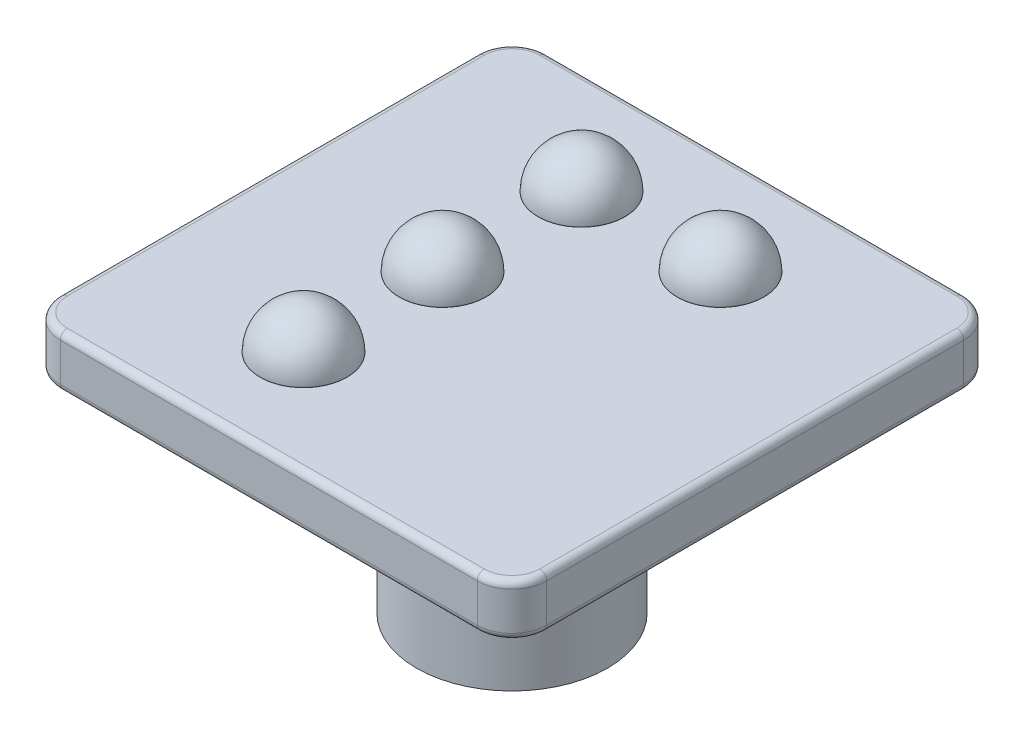
from build123d import *

# Parameters (mm, degrees)
BOSS_EXTRUDE1_DEPTH = 1.5
SKETCH2_R           = 2.75
BOSS_EXTRUDE2_DEPTH = 6
SKETCH3_W           = 1.1
SKETCH3_H           = 1.45
SKETCH3_W_2         = 1.45
SKETCH3_H_2         = 1.1
CUT_EXTRUDE1_DEPTH  = 6
CHAMFER1_SIZE       = 0.3
FILLET1_R           = 1
SKETCH4_R           = 1.25
BOSS_EXTRUDE3_DEPTH = 0.01
DOME1_FACE_RADIUS   = 1.25
DOME1_HEIGHT        = 1.25
DOME2_FACE_RADIUS   = 1.25
DOME2_HEIGHT        = 1.25
DOME3_FACE_RADIUS   = 1.25
DOME3_HEIGHT        = 1.25
DOME5_FACE_RADIUS   = 1.25
DOME5_HEIGHT        = 1.25
FILLET3_R           = 0.2


with BuildPart() as part:
    # Sketch1 → Boss-Extrude1 (new body)
    with BuildSketch(Plane(origin=(0, 0, 0), x_dir=(1, 0, 0), z_dir=(0, 1, 0))):
        with BuildLine():
            Line((-7.324675649, 4.396717546), (4.675324351, 4.396717546))
            ThreePointArc((4.675324351, 4.396717546), (5.382431132, 4.103824327), (5.675324351, 3.396717546))
            Line((5.675324351, 3.396717546), (5.675324351, -8.603282454))
            ThreePointArc((5.675324351, -8.603282454), (5.382431132, -9.310389235), (4.675324351, -9.603282454))
            Line((4.675324351, -9.603282454), (-7.324675649, -9.603282454))
            ThreePointArc((-7.324675649, -9.603282454), (-8.03178243, -9.310389235), (-8.324675649, -8.603282454))
            Line((-8.324675649, -8.603282454), (-8.324675649, 3.396717546))
            ThreePointArc((-8.324675649, 3.396717546), (-8.03178243, 4.103824327), (-7.324675649, 4.396717546))
        make_face()
    extrude(amount=BOSS_EXTRUDE1_DEPTH)

    # Sketch2 → Boss-Extrude2 (add)
    with BuildSketch(Plane.XZ):
        with Locations(Location((-1.324675649, 2.603282454, 0), (0, 0, 270))):
            Circle(SKETCH2_R)
    extrude(amount=BOSS_EXTRUDE2_DEPTH)

    # Sketch3 → Cut-Extrude1 (cut)
    with BuildSketch(Plane.XZ.offset(6)):
        with Locations((-1.324675649, 3.878282454)):
            Rectangle(SKETCH3_W, SKETCH3_H)
        with Locations((-0.049675649, 2.603282454)):
            Rectangle(SKETCH3_W_2, SKETCH3_H_2)
        with Locations((-1.324675649, 2.603282454)):
            Rectangle(SKETCH3_W, SKETCH3_H_2)
        with Locations((-2.599675649, 2.603282454)):
            Rectangle(SKETCH3_W_2, SKETCH3_H_2)
        with Locations((-1.324675649, 1.328282454)):
            Rectangle(SKETCH3_W, SKETCH3_H)
    extrude(amount=-CUT_EXTRUDE1_DEPTH, mode=Mode.SUBTRACT)

    # Chamfer1
    chamfer1_edges = [part.edges().sort_by_distance(p)[0] for p in [
        (-0.774675649, -6, 3.878282454),
        (-0.049675649, -6, 3.153282454),
        (0.675324351, -6, 2.603282454),
        (-0.774675649, -6, 1.328282454),
        (-2.599675649, -6, 3.153282454),
        (-1.324675649, -6, 4.603282454),
        (-1.874675649, -6, 3.878282454),
        (-3.324675649, -6, 2.603282454),
        (-2.599675649, -6, 2.053282454),
        (-1.874675649, -6, 1.328282454),
        (-1.324675649, -6, 0.603282454),
        (-0.049675649, -6, 2.053282454),
    ]]
    chamfer(chamfer1_edges, length=CHAMFER1_SIZE)

    # Fillet1
    fillet1_edges = [part.edges().sort_by_distance(p)[0] for p in [
        (-1.324675649, 0, 5.353282454),
    ]]
    fillet(fillet1_edges, radius=FILLET1_R)

    # Sketch4 → Boss-Extrude3 (add)
    with BuildSketch(Plane(origin=(0, 1.5, 0), x_dir=(1, 0, 0), z_dir=(0, 1, 0))):
        with Locations(Location((-3.324675649, 1.396717546, 0), (0, 0, 90))):
            Circle(SKETCH4_R)
        with Locations(Location((-3.324675649, -2.603282454, 0), (0, 0, 90))):
            Circle(SKETCH4_R)
        with Locations(Location((-3.324675649, -6.603282454, 0), (0, 0, 90))):
            Circle(SKETCH4_R)
        with Locations(Location((0.675324351, 1.396717546, 0), (0, 0, 90))):
            Circle(SKETCH4_R)
    extrude(amount=BOSS_EXTRUDE3_DEPTH)

    # Dome1: a dome of height H over a round flat face of radius A is a cap of a sphere of radius (A * A + H * H) / (2 * H)
    dome1_r = (DOME1_FACE_RADIUS * DOME1_FACE_RADIUS + DOME1_HEIGHT * DOME1_HEIGHT) / (2 * DOME1_HEIGHT)
    dome1_base = Plane((-3.324675649, 1.51, -1.396717546), z_dir=(0, 1, 0))
    with Locations(dome1_base.offset(DOME1_HEIGHT - dome1_r)):
        dome1_ball = Sphere(dome1_r, mode=Mode.PRIVATE)
    add(split(dome1_ball, bisect_by=dome1_base, keep=Keep.TOP, mode=Mode.PRIVATE))

    # Dome2: a dome of height H over a round flat face of radius A is a cap of a sphere of radius (A * A + H * H) / (2 * H)
    dome2_r = (DOME2_FACE_RADIUS * DOME2_FACE_RADIUS + DOME2_HEIGHT * DOME2_HEIGHT) / (2 * DOME2_HEIGHT)
    dome2_base = Plane((0.675324351, 1.51, -1.396717546), z_dir=(0, 1, 0))
    with Locations(dome2_base.offset(DOME2_HEIGHT - dome2_r)):
        dome2_ball = Sphere(dome2_r, mode=Mode.PRIVATE)
    add(split(dome2_ball, bisect_by=dome2_base, keep=Keep.TOP, mode=Mode.PRIVATE))

    # Dome3: a dome of height H over a round flat face of radius A is a cap of a sphere of radius (A * A + H * H) / (2 * H)
    dome3_r = (DOME3_FACE_RADIUS * DOME3_FACE_RADIUS + DOME3_HEIGHT * DOME3_HEIGHT) / (2 * DOME3_HEIGHT)
    dome3_base = Plane((-3.324675649, 1.51, 2.603282454), z_dir=(0, 1, 0))
    with Locations(dome3_base.offset(DOME3_HEIGHT - dome3_r)):
        dome3_ball = Sphere(dome3_r, mode=Mode.PRIVATE)
    add(split(dome3_ball, bisect_by=dome3_base, keep=Keep.TOP, mode=Mode.PRIVATE))

    # Dome5: a dome of height H over a round flat face of radius A is a cap of a sphere of radius (A * A + H * H) / (2 * H)
    dome5_r = (DOME5_FACE_RADIUS * DOME5_FACE_RADIUS + DOME5_HEIGHT * DOME5_HEIGHT) / (2 * DOME5_HEIGHT)
    dome5_base = Plane((-3.324675649, 1.51, 6.603282454), z_dir=(0, 1, 0))
    with Locations(dome5_base.offset(DOME5_HEIGHT - dome5_r)):
        dome5_ball = Sphere(dome5_r, mode=Mode.PRIVATE)
    add(split(dome5_ball, bisect_by=dome5_base, keep=Keep.TOP, mode=Mode.PRIVATE))

    # Fillet3
    fillet3_edges = [part.edges().sort_by_distance(p)[0] for p in [
        (5.382431132, 1.5, 9.310389235),
        (-1.324675649, 0, 9.603282454),
        (-8.03178243, 0, 9.310389235),
        (5.675324351, 1.5, 2.603282454),
        (5.382431132, 1.5, -4.103824327),
        (-1.324675649, 1.5, -4.396717546),
        (-8.03178243, 1.5, -4.103824327),
        (-8.324675649, 1.5, 2.603282454),
        (-8.03178243, 1.5, 9.310389235),
        (-1.324675649, 1.5, 9.603282454),
        (-8.324675649, 0, 2.603282454),
        (-8.03178243, 0, -4.103824327),
        (-1.324675649, 0, -4.396717546),
        (5.382431132, 0, -4.103824327),
        (5.675324351, 0, 2.603282454),
        (5.382431132, 0, 9.310389235),
    ]]
    fillet(fillet3_edges, radius=FILLET3_R)


solid = part.part
